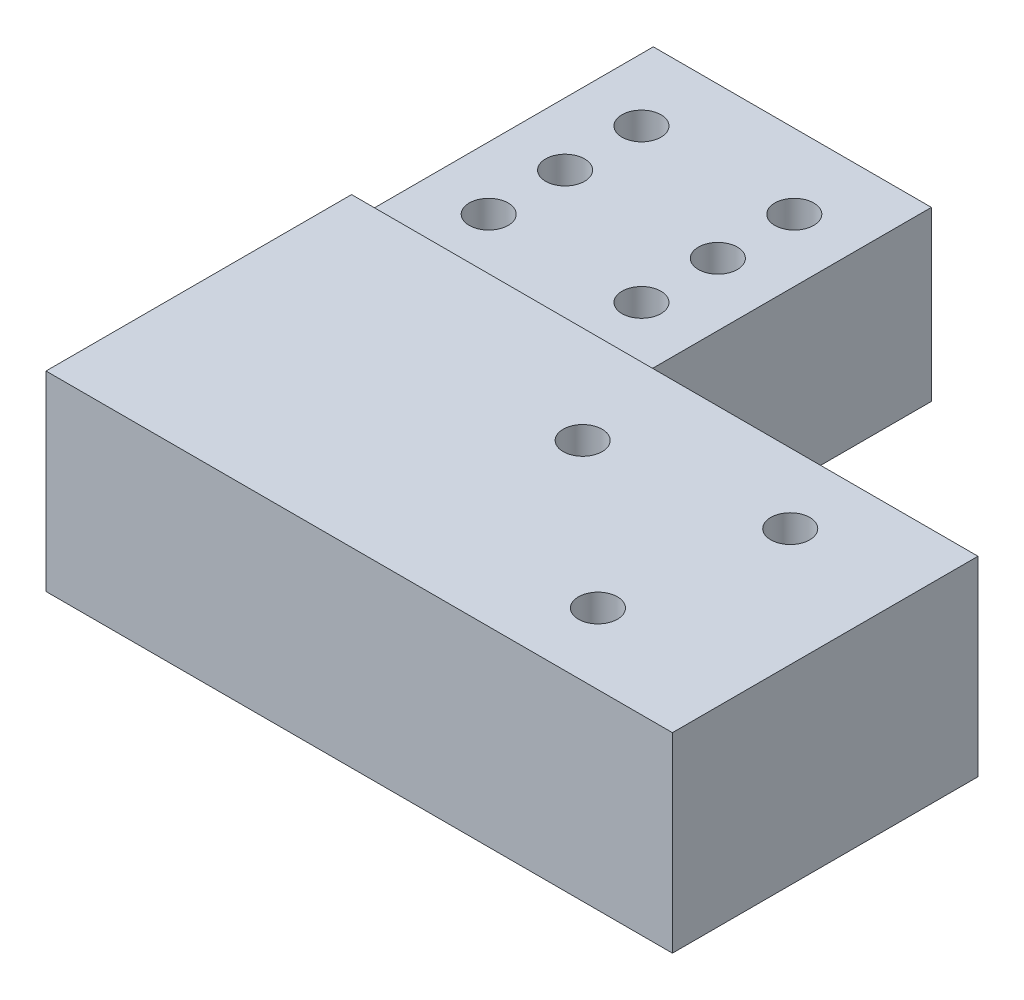
from build123d import *

# Parameters (mm, degrees)
SKETCH1_W               = 36.4
SKETCH1_H               = 39.5
SKETCH1_R               = 2.55
BOSS_EXTRUDE1_DEPTH     = 22
BOSS_EXTRUDE2_START     = -22
SKETCH2_W               = 82
SKETCH2_H               = 40
BOSS_EXTRUDE2_DEPTH     = 25
F_5_0MM_DOWEL_HOLE1_D   = 5.1
CUT_EXTRUDE1_DEPTH      = 30
CUT_EXTRUDE1_DEPTH_BACK = 50
SKETCH3_W               = 85.710853131
SKETCH3_H               = 93.141989814


with BuildPart() as part:
    # Sketch1 → Boss-Extrude1 (new body)
    with BuildSketch(Plane(origin=(0, 0, 0), x_dir=(1, 0, 0), z_dir=(0, 1, 0))):
        with Locations((18.2, 19.75)):
            Rectangle(SKETCH1_W, SKETCH1_H)
        with Locations(Location((8.2, 29.75, 0), (0, 0, 270))):
            Circle(SKETCH1_R, mode=Mode.SUBTRACT)
        with Locations(Location((28.2, 29.75, 0), (0, 0, 270))):
            Circle(SKETCH1_R, mode=Mode.SUBTRACT)
        with Locations(Location((28.2, 19.75, 0), (0, 0, 270))):
            Circle(SKETCH1_R, mode=Mode.SUBTRACT)
        with Locations(Location((28.2, 9.75, 0), (0, 0, 270))):
            Circle(SKETCH1_R, mode=Mode.SUBTRACT)
        with Locations(Location((8.2, 19.75, 0), (0, 0, 270))):
            Circle(SKETCH1_R, mode=Mode.SUBTRACT)
        with Locations(Location((8.2, 9.75, 0), (0, 0, 270))):
            Circle(SKETCH1_R, mode=Mode.SUBTRACT)
    boss_extrude1 = extrude(amount=BOSS_EXTRUDE1_DEPTH)

    # Sketch2 → Boss-Extrude2 (add)
    with BuildSketch(Plane(origin=(0, 22, 0), x_dir=(1, 0, 0), z_dir=(0, 1, 0)).offset(BOSS_EXTRUDE2_START)):
        with Locations((41, 59.5)):
            Rectangle(SKETCH2_W, SKETCH2_H)
    boss_extrude2 = extrude(amount=BOSS_EXTRUDE2_DEPTH)

    # Mirror3: Boss-Extrude1, Boss-Extrude2 across plane
    add(boss_extrude1.mirror(Plane(origin=(0, 22, 0), x_dir=(1, 0, 0), z_dir=(0, 0, -1))))
    add(boss_extrude2.mirror(Plane(origin=(0, 22, 0), x_dir=(1, 0, 0), z_dir=(0, 0, -1))))

    # Ø5.0mm Dowel Hole1 (through all)
    with Locations(Plane(origin=(42.996100309, 25, 52.24566701), x_dir=(0, 0, 1), z_dir=(0, 1, 0))):
        with Locations((0, 0), (18, 20), (-3.585786438, 23.585786437)):
            Hole(F_5_0MM_DOWEL_HOLE1_D / 2)

    # Sketch3 → Cut-Extrude1 (cut, two sides: drawn at the far end of the back side and taken through both)
    with BuildSketch(Plane(origin=(0, 22, 0), x_dir=(1, 0, 0), z_dir=(0, 1, 0)).offset(-CUT_EXTRUDE1_DEPTH_BACK)):
        with Locations((42.855426566, 46.570994907)):
            Rectangle(SKETCH3_W, SKETCH3_H)
    extrude(amount=CUT_EXTRUDE1_DEPTH + CUT_EXTRUDE1_DEPTH_BACK, mode=Mode.SUBTRACT)


solid = part.part
